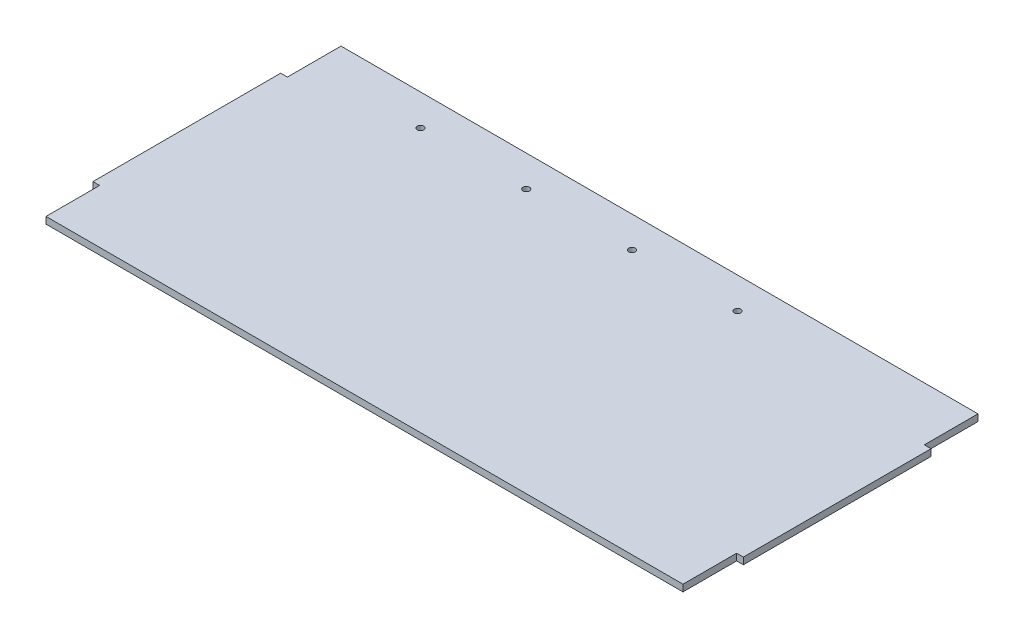
from build123d import *

# Parameters (mm, degrees)
BOSS_EXTRUDE1_DEPTH = 3.175
SKETCH3_R           = 1.5494
CUT_EXTRUDE1_DEPTH  = 170.119050616


with BuildPart() as part:
    # Sketch1 → Boss-Extrude1 (new body)
    with BuildSketch(Plane(origin=(0, 0, 0), x_dir=(1, 0, 0), z_dir=(0, 1, 0))):
        Polygon((-150.8125, 44.45), (-153.9875, 44.45), (-153.9875, -44.45), (-150.8125, -44.45), (-150.8125, -69.85), (150.8125, -69.85), (150.8125, -44.45), (153.9875, -44.45), (153.9875, 44.45), (150.8125, 44.45), (150.8125, 69.85), (-150.8125, 69.85), align=None)
    extrude(amount=BOSS_EXTRUDE1_DEPTH)

    # Sketch3 → Cut-Extrude1 (cut, through all)
    with BuildSketch(Plane(origin=(0, 3.175, 0), x_dir=(1, 0, 0), z_dir=(0, 1, 0))):
        with Locations(Location((-98.37039, 55.087774, 0), (0, 0, 270))):
            Circle(SKETCH3_R)
        with Locations(Location((-48.33239, 55.087774, 0), (0, 0, 270))):
            Circle(SKETCH3_R)
        with Locations(Location((1.70561, 55.087774, 0), (0, 0, 270))):
            Circle(SKETCH3_R)
        with Locations(Location((51.74361, 55.087774, 0), (0, 0, 270))):
            Circle(SKETCH3_R)
    extrude(amount=-CUT_EXTRUDE1_DEPTH, mode=Mode.SUBTRACT)


solid = part.part
